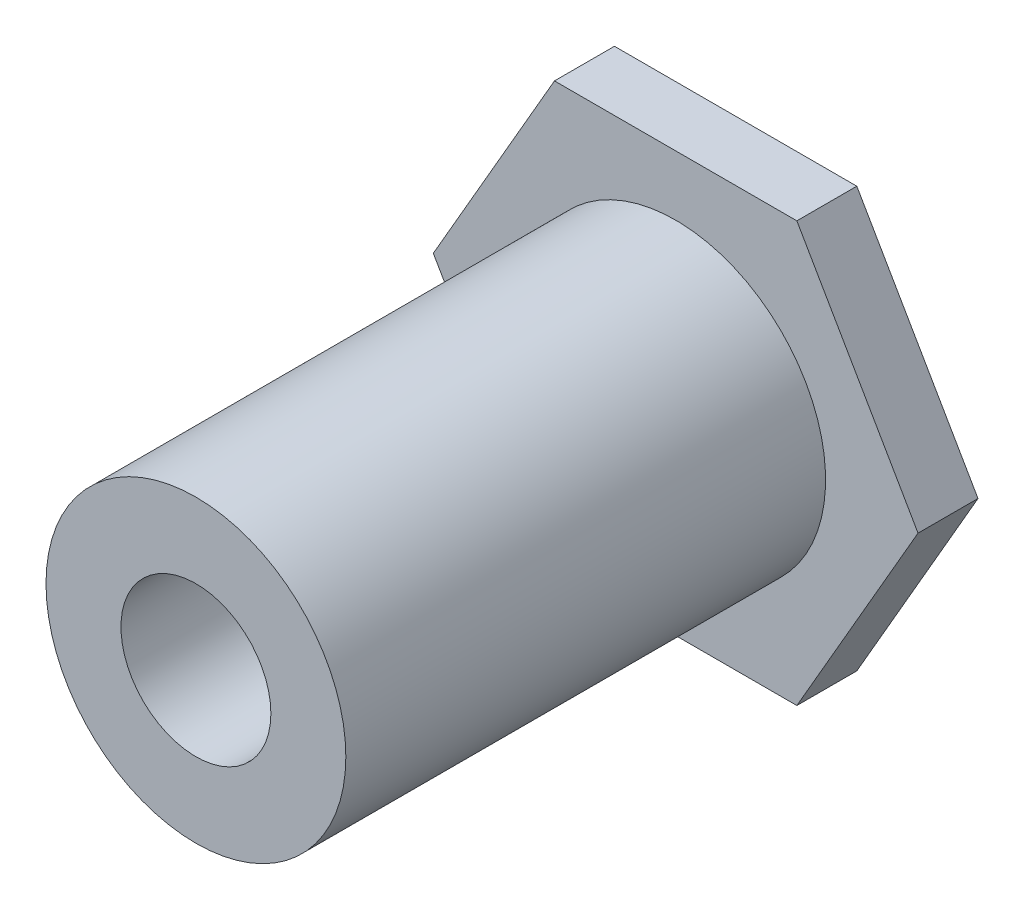
from build123d import *

# Parameters (mm, degrees)
SKETCH_1_R      = 2.5
SKETCH_1_R_2    = 1.25
EXTRUDE_1_DEPTH = 8
EXTRUDE_2_DEPTH = 1


with BuildPart() as part:
    # 草图1 → 凸台-拉伸1 (new body)
    with BuildSketch(Plane.XY):
        Circle(SKETCH_1_R)
        Circle(SKETCH_1_R_2, mode=Mode.SUBTRACT)
    extrude(amount=EXTRUDE_1_DEPTH)

    # 草图2 → 凸台-拉伸2 (add)
    with BuildSketch(Plane(origin=(0, 0, 0), x_dir=(-1, 0, 0), z_dir=(0, 0, -1))):
        Polygon((-2.020725942, -3.5), (2.020725942, -3.5), (4.041451884, 0), (2.020725942, 3.5), (-2.020725942, 3.5), (-4.041451884, 0), align=None)
    extrude(amount=EXTRUDE_2_DEPTH)


solid = part.part
